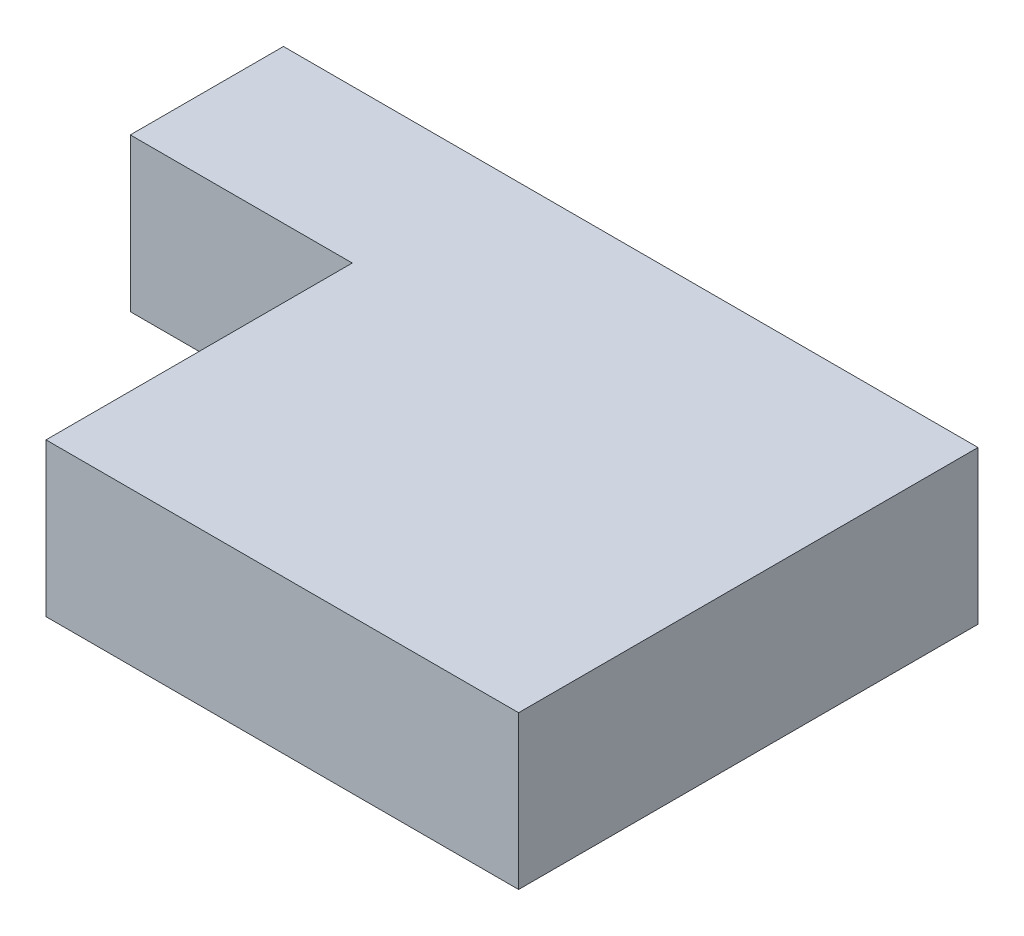
from build123d import *

# Parameters (mm, degrees)
SKETCH1_W           = 21.7714322
SKETCH1_H           = 14.400000156
BOSS_EXTRUDE1_DEPTH = 4.800000052
SKETCH2_W           = 6.957144159
SKETCH2_H           = 9.600000104
CUT_EXTRUDE1_DEPTH  = 27.540445833


with BuildPart() as part:
    # Sketch1 → Boss-Extrude1 (new body)
    with BuildSketch(Plane(origin=(0, 0, 0), x_dir=(1, 0, 0), z_dir=(0, 1, 0))):
        with Locations((10.8857161, 7.200000078)):
            Rectangle(SKETCH1_W, SKETCH1_H)
    extrude(amount=BOSS_EXTRUDE1_DEPTH)

    # Sketch2 → Cut-Extrude1 (cut, through all)
    with BuildSketch(Plane(origin=(0, 4.800000052, 0), x_dir=(1, 0, 0), z_dir=(0, 1, 0))):
        with Locations((3.47857208, 4.800000052)):
            Rectangle(SKETCH2_W, SKETCH2_H)
    extrude(amount=-CUT_EXTRUDE1_DEPTH, mode=Mode.SUBTRACT)


solid = part.part
